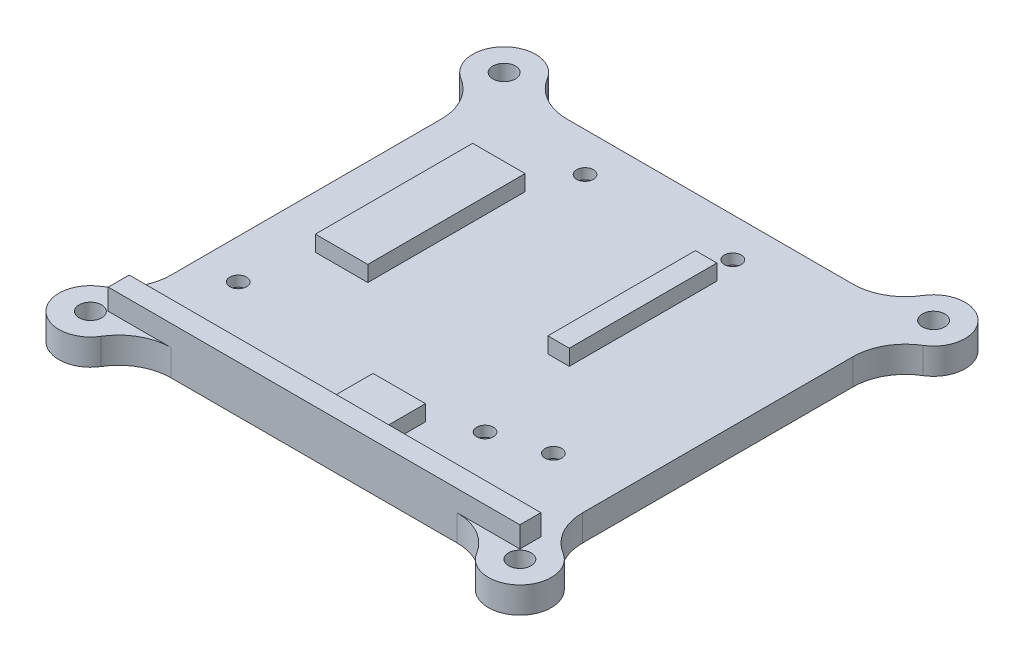
from build123d import *

# Parameters (mm, degrees)
SKETCH1_W           = 78.5
SKETCH1_H           = 75.5
BOSS_EXTRUDE1_DEPTH = 5
SKETCH2_W           = 10
SKETCH2_H           = 30
SKETCH2_W_2         = 4.083917928
SKETCH2_H_2         = 28.145920853
SKETCH2_H_3         = 8
BOSS_EXTRUDE2_DEPTH = 3
SKETCH6_R           = 2.15
BOSS_EXTRUDE3_DEPTH = 5
SKETCH3_R           = 1.6
CUT_EXTRUDE3_DEPTH  = 10
SKETCH5_R           = 3.25
CUT_EXTRUDE4_DEPTH  = 3
SKETCH9_W           = 78.5
SKETCH9_H           = 4
BOSS_EXTRUDE5_DEPTH = 4
FILLET2_R           = 10
FILLET3_R           = 10
FILLET4_R           = 10
FILLET5_R           = 10
FILLET6_R           = 10
FILLET7_R           = 10
FILLET8_R           = 10
FILLET9_R           = 10


with BuildPart() as part:
    # Sketch1 → Boss-Extrude1 (new body)
    with BuildSketch(Plane(origin=(0, 0, 0), x_dir=(1, 0, 0), z_dir=(0, 1, 0))):
        with Locations((39.25, 37.75)):
            Rectangle(SKETCH1_W, SKETCH1_H)
    extrude(amount=BOSS_EXTRUDE1_DEPTH)

    # Sketch2 → Boss-Extrude2 (add)
    with BuildSketch(Plane(origin=(0, 5, 0), x_dir=(1, 0, 0), z_dir=(0, 1, 0))):
        with Locations((15, 44.5)):
            Rectangle(SKETCH2_W, SKETCH2_H)
        with Locations((51.006989776, 48.944975154)):
            Rectangle(SKETCH2_W_2, SKETCH2_H_2)
        with Locations((43.5, 8)):
            Rectangle(SKETCH2_W, SKETCH2_H_3)
    extrude(amount=BOSS_EXTRUDE2_DEPTH)

    # Sketch6 → Boss-Extrude3 (add)
    # profile 1 of 4: a face of its own
    with BuildSketch(Plane(origin=(0, 0, 0), x_dir=(1, 0, 0), z_dir=(0, 1, 0))):
        with BuildLine():
            Line((0, 0), (0, 4.054128952))
            ThreePointArc((0, 4.054128952), (-5.942640687, -5.942640687), (4.054128952, 0))
            Line((4.054128952, 0), (0, 0))
        make_face()
        with Locations(Location((-1.7, -1.7, 0), (0, 0, 270))):
            Circle(SKETCH6_R, mode=Mode.SUBTRACT)
    # profile 2 of 4: a face of its own
    with BuildSketch(Plane(origin=(0, 0, 0), x_dir=(1, 0, 0), z_dir=(0, 1, 0))):
        with BuildLine():
            ThreePointArc((78.5, 4.054128952), (84.442640687, -5.942640687), (74.445871048, 0))
            Line((74.445871048, 0), (78.5, 0))
            Line((78.5, 0), (78.5, 4.054128952))
        make_face()
        with Locations(Location((80.2, -1.7, 0), (0, 0, 270))):
            Circle(SKETCH6_R, mode=Mode.SUBTRACT)
    # profile 3 of 4: a face of its own
    with BuildSketch(Plane(origin=(0, 0, 0), x_dir=(1, 0, 0), z_dir=(0, 1, 0))):
        with BuildLine():
            ThreePointArc((0, 71.445871048), (-5.942640687, 81.442640687), (4.054128952, 75.5))
            Line((4.054128952, 75.5), (0, 75.5))
            Line((0, 75.5), (0, 71.445871048))
        make_face()
        with Locations(Location((-1.7, 77.2, 0), (0, 0, 270))):
            Circle(SKETCH6_R, mode=Mode.SUBTRACT)
    # profile 4 of 4: a face of its own
    with BuildSketch(Plane(origin=(0, 0, 0), x_dir=(1, 0, 0), z_dir=(0, 1, 0))):
        with BuildLine():
            Line((78.5, 75.5), (78.5, 71.445871048))
            ThreePointArc((78.5, 71.445871048), (84.442640687, 81.442640687), (74.445871048, 75.5))
            Line((74.445871048, 75.5), (78.5, 75.5))
        make_face()
        with Locations(Location((80.2, 77.2, 0), (0, 0, 270))):
            Circle(SKETCH6_R, mode=Mode.SUBTRACT)
    extrude(amount=BOSS_EXTRUDE3_DEPTH)

    # Sketch3 → Cut-Extrude3 (cut)
    with BuildSketch(Plane(origin=(0, 5, 0), x_dir=(1, 0, 0), z_dir=(0, 1, 0))):
        with Locations(Location((7.54, 17.25, 0), (0, 0, 270))):
            Circle(SKETCH3_R)
        with Locations(Location((55.86, 16, 0), (0, 0, 270))):
            Circle(SKETCH3_R)
        with Locations(Location((22.87, 68.06, 0), (0, 0, 270))):
            Circle(SKETCH3_R)
        with Locations(Location((51.04, 68.06, 0), (0, 0, 270))):
            Circle(SKETCH3_R)
        with Locations(Location((65.9, 19, 0), (0, 0, 270))):
            Circle(SKETCH3_R)
    extrude(amount=-CUT_EXTRUDE3_DEPTH, mode=Mode.SUBTRACT)

    # Sketch5 → Cut-Extrude4 (cut)
    with BuildSketch(Plane.XZ):
        with Locations(Location((7.54, -17.25, 0), (0, 0, 270))):
            Circle(SKETCH5_R)
        with Locations(Location((55.86, -16, 0), (0, 0, 270))):
            Circle(SKETCH5_R)
        with Locations(Location((22.87, -68.06, 0), (0, 0, 270))):
            Circle(SKETCH5_R)
        with Locations(Location((51.04, -68.06, 0), (0, 0, 270))):
            Circle(SKETCH5_R)
        with Locations(Location((65.9, -19, 0), (0, 0, 270))):
            Circle(SKETCH5_R)
    extrude(amount=-CUT_EXTRUDE4_DEPTH, mode=Mode.SUBTRACT)

    # Sketch9 → Boss-Extrude5 (add)
    with BuildSketch(Plane(origin=(0, 5, 0), x_dir=(1, 0, 0), z_dir=(0, 1, 0))):
        with Locations((39.25, 2)):
            Rectangle(SKETCH9_W, SKETCH9_H)
    extrude(amount=BOSS_EXTRUDE5_DEPTH)

    # Fillet2
    fillet2_edges = [part.edges().sort_by_distance(p)[0] for p in [
        (4.054128952, 2.5, 0),
    ]]
    fillet(fillet2_edges, radius=FILLET2_R)

    # Fillet3
    fillet3_edges = [part.edges().sort_by_distance(p)[0] for p in [
        (74.445871048, 2.5, 0),
    ]]
    fillet(fillet3_edges, radius=FILLET3_R)

    # Fillet4
    fillet4_edges = [part.edges().sort_by_distance(p)[0] for p in [
        (78.5, 2.5, -4.054128952),
    ]]
    fillet(fillet4_edges, radius=FILLET4_R)

    # Fillet5
    fillet5_edges = [part.edges().sort_by_distance(p)[0] for p in [
        (78.5, 2.5, -71.445871048),
    ]]
    fillet(fillet5_edges, radius=FILLET5_R)

    # Fillet6
    fillet6_edges = [part.edges().sort_by_distance(p)[0] for p in [
        (74.445871048, 2.5, -75.5),
    ]]
    fillet(fillet6_edges, radius=FILLET6_R)

    # Fillet7
    fillet7_edges = [part.edges().sort_by_distance(p)[0] for p in [
        (4.054128952, 2.5, -75.5),
    ]]
    fillet(fillet7_edges, radius=FILLET7_R)

    # Fillet8
    fillet8_edges = [part.edges().sort_by_distance(p)[0] for p in [
        (0, 2.5, -71.445871048),
    ]]
    fillet(fillet8_edges, radius=FILLET8_R)

    # Fillet9
    fillet9_edges = [part.edges().sort_by_distance(p)[0] for p in [
        (0, 2.5, -4.054128952),
    ]]
    fillet(fillet9_edges, radius=FILLET9_R)


solid = part.part
